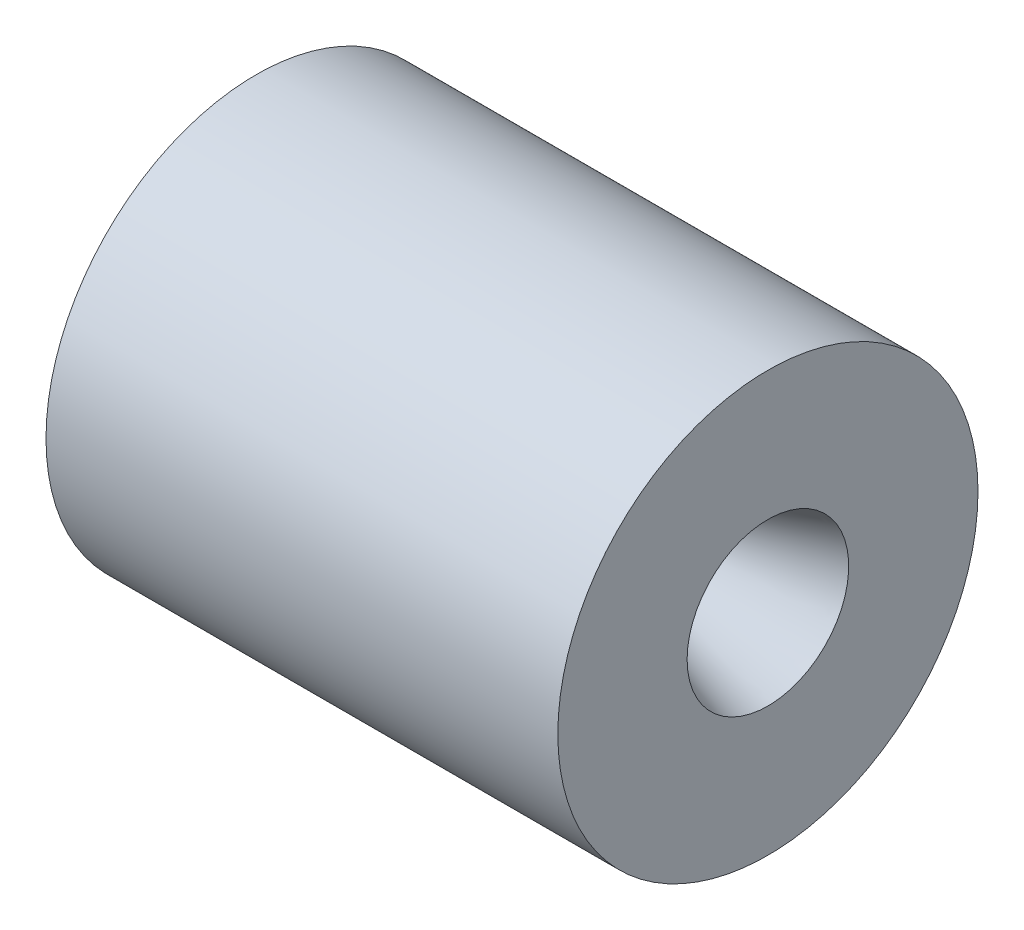
from build123d import *

# Parameters (mm, degrees)
CIRPATTERN1_COUNT = 12


with BuildPart() as part:
    # Model → Revolve1 (revolve)
    with BuildSketch(Plane.XY, mode=Mode.PRIVATE) as revolve1_sk:
        with BuildLine():
            Line((0, 55.140272), (23.150958, 55.140272))
            ThreePointArc((23.150958, 55.140272), (60.421138671, 50.233559208), (95.151418, 35.847806))
            Line((95.151418, 35.847806), (128.566947896, 16.55534082))
            ThreePointArc((128.566947896, 16.55534082), (133.553991718, 14.489639839), (138.905748896, 13.78506782))
            ThreePointArc((138.905748896, 13.78506782), (139.768990342, 13.856305516), (140.608875713, 14.068091181))
            add(Edge.make_bspline(
                [(140.608875713, 14.068091181), (181.460140896, 28.03089782), (185.649173896, 29.31027082)],
                knots=[0, 0, 0, 1, 1, 1], degree=2))
            Line((185.649173896, 29.31027082), (185.649173896, 76.200272))
            Line((185.649173896, 76.200272), (0, 76.200272))
            Line((0, 76.200272), (0, 55.140272))
        make_face()
    revolve(revolve1_sk.sketch.rotate(Axis((0, 0, 0), (1, 0, 0)), 90), axis=Axis((0, 0, 0), (1, 0, 0)))

    # Sketch3 → #21 (0.159) Diameter Hole1 (revolve, cut)
    with BuildSketch(Plane(origin=(0, 0, 69), x_dir=(0, 0, 1), z_dir=(0, 1, 0))):
        Polygon((0, 0), (0, 26.213317848), (2.0193, 25), (2.0193, 0), align=None)
    f_21_0_159_diameter_hole1 = revolve(axis=Axis((-6.35, 0, 69), (1, 0, 0)), mode=Mode.SUBTRACT)

    # CirPattern1: #21 (0.159) Diameter Hole1 ×12 about axis
    cirpattern1_axis = Axis((0, 0, 0), (1, 0, 0))
    for i in range(1, CIRPATTERN1_COUNT):
        add(f_21_0_159_diameter_hole1.rotate(cirpattern1_axis, i * 360 / CIRPATTERN1_COUNT), mode=Mode.SUBTRACT)


solid = part.part
